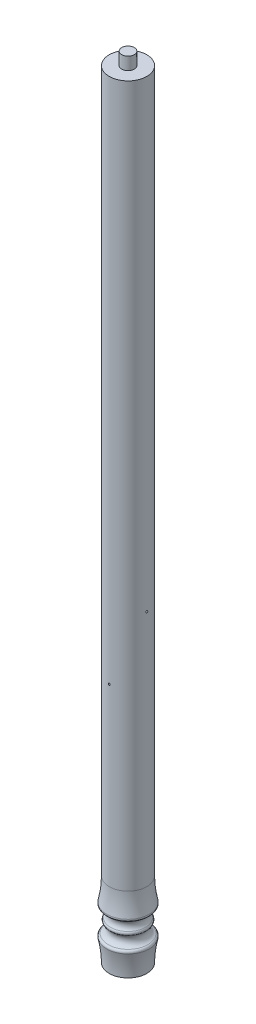
from build123d import *

# Parameters (mm, degrees)
CUT_EXTRUDE1_START = -12.7
SKETCH15_R         = 0.9921875
CUT_EXTRUDE1_DEPTH = 12.7
CUT_EXTRUDE2_START = -12.7
SKETCH16_R         = 0.9921875
CUT_EXTRUDE2_DEPTH = 12.7


with BuildPart() as part:
    # revolve sketch → Revolve1 (revolve)
    with BuildSketch(Plane.XY, mode=Mode.PRIVATE) as revolve1_sk:
        with BuildLine():
            Line((0, 0), (19.05, 0))
            ThreePointArc((19.05, 0), (19.692539758, 11.497446902), (21.612156952, 22.851706562))
            ThreePointArc((21.612156952, 22.851706562), (21.368821871, 24.623609523), (20.018018165, 25.795864363))
            ThreePointArc((20.018018165, 25.795864363), (17.012666806, 28.123144244), (15.875, 31.75))
            ThreePointArc((15.875, 31.75), (16.370840305, 34.209941923), (17.780925752, 36.285714286))
            ThreePointArc((17.780925752, 36.285714286), (18.543296053, 38.1), (17.780925752, 39.914285714))
            ThreePointArc((17.780925752, 39.914285714), (16.370840305, 41.990058077), (15.875, 44.45))
            ThreePointArc((15.875, 44.45), (17.012666806, 48.076855756), (20.018018165, 50.404135637))
            ThreePointArc((20.018018165, 50.404135637), (21.368821871, 51.576390477), (21.612156952, 53.348293438))
            ThreePointArc((21.612156952, 53.348293438), (19.692539758, 64.702553098), (19.05, 76.2))
            Line((19.05, 76.2), (19.05, 787.4))
            Line((19.05, 787.4), (6.35, 787.4))
            Line((6.35, 787.4), (6.35, 800.1))
            Line((6.35, 800.1), (0, 800.1))
            Line((0, 800.1), (0, 0))
        make_face()
    revolve(revolve1_sk.sketch.rotate(Axis((0, -55, 0), (0, 1, 0)), 90), axis=Axis((0, -55, 0), (0, 1, 0)))

    # Sketch15 → Cut-Extrude1 (cut)
    with BuildSketch(Plane.XY.offset(19.05).offset(CUT_EXTRUDE1_START)):
        with Locations((0, 254)):
            Circle(SKETCH15_R)
    extrude(amount=CUT_EXTRUDE1_DEPTH, mode=Mode.SUBTRACT)

    # Sketch16 → Cut-Extrude2 (cut)
    with BuildSketch(Plane(origin=(19.05, 0, 0), x_dir=(0, 0, -1), z_dir=(1, 0, 0)).offset(CUT_EXTRUDE2_START)):
        with Locations((0, 317.5)):
            Circle(SKETCH16_R)
    extrude(amount=CUT_EXTRUDE2_DEPTH, mode=Mode.SUBTRACT)


solid = part.part
